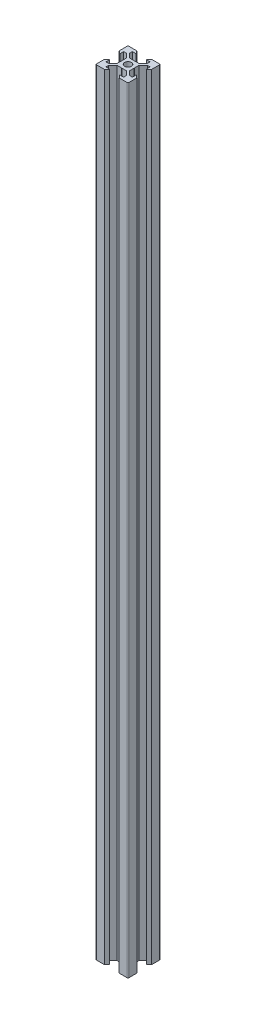
from build123d import *

# Parameters (mm, degrees)
BOSS_EXTRUDE1_DEPTH = 480


with BuildPart() as part:
    # Sketch1 → Boss-Extrude1 (new body)
    with BuildSketch(Plane(origin=(0, 0, 0), x_dir=(1, 0, 0), z_dir=(0, 1, 0))):
        with BuildLine():
            Line((20, 5.42), (20, 0.5))
            ThreePointArc((20, 0.5), (19.853553391, 0.146446609), (19.5, 0))
            Line((19.5, 0), (14.58, 0))
            Line((14.58, 0), (13.13, 1.549339828))
            Line((13.13, 1.549339828), (13.13, 1.799339828))
            Line((13.13, 1.799339828), (15.5, 1.799339828))
            Line((15.5, 1.799339828), (15.5, 3.439339828))
            Line((15.5, 3.439339828), (12.84, 6.099339828))
            Line((12.84, 6.099339828), (10.25, 6.099339828))
            Line((10.25, 6.099339828), (10, 6.349339828))
            Line((10, 6.349339828), (9.75, 6.099339828))
            Line((9.75, 6.099339828), (7.16, 6.099339828))
            Line((7.16, 6.099339828), (4.5, 3.439339828))
            Line((4.5, 3.439339828), (4.5, 1.799339828))
            Line((4.5, 1.799339828), (6.875, 1.799339828))
            Line((6.875, 1.799339828), (6.875, 1.549339828))
            Line((6.875, 1.549339828), (5.42, 0))
            Line((5.42, 0), (0.5, 0))
            ThreePointArc((0.5, 0), (0.146446609, 0.146446609), (0, 0.5))
            Line((0, 0.5), (0, 5.42))
            Line((0, 5.42), (1.549339828, 6.87))
            Line((1.549339828, 6.87), (1.799339828, 6.87))
            Line((1.799339828, 6.87), (1.799339828, 4.5))
            Line((1.799339828, 4.5), (3.439339828, 4.5))
            Line((3.439339828, 4.5), (6.099339828, 7.16))
            Line((6.099339828, 7.16), (6.099339828, 9.75))
            Line((6.099339828, 9.75), (6.349339828, 10))
            Line((6.349339828, 10), (6.099339828, 10.25))
            Line((6.099339828, 10.25), (6.099339828, 12.84))
            Line((6.099339828, 12.84), (3.439339828, 15.5))
            Line((3.439339828, 15.5), (1.799339828, 15.5))
            Line((1.799339828, 15.5), (1.799339828, 13.125))
            Line((1.799339828, 13.125), (1.549339828, 13.125))
            Line((1.549339828, 13.125), (0, 14.58))
            Line((0, 14.58), (0, 19.5))
            ThreePointArc((0, 19.5), (0.146446609, 19.853553391), (0.5, 20))
            Line((0.5, 20), (5.42, 20))
            Line((5.42, 20), (6.87, 18.450660172))
            Line((6.87, 18.450660172), (6.87, 18.200660172))
            Line((6.87, 18.200660172), (4.5, 18.200660172))
            Line((4.5, 18.200660172), (4.5, 16.560660172))
            Line((4.5, 16.560660172), (7.16, 13.900660172))
            Line((7.16, 13.900660172), (9.75, 13.900660172))
            Line((9.75, 13.900660172), (10, 13.650660172))
            Line((10, 13.650660172), (10.25, 13.900660172))
            Line((10.25, 13.900660172), (12.84, 13.900660172))
            Line((12.84, 13.900660172), (15.5, 16.560660172))
            Line((15.5, 16.560660172), (15.5, 18.200660172))
            Line((15.5, 18.200660172), (13.125, 18.200660172))
            Line((13.125, 18.200660172), (13.125, 18.450660172))
            Line((13.125, 18.450660172), (14.58, 20))
            Line((14.58, 20), (19.5, 20))
            ThreePointArc((19.5, 20), (19.853553391, 19.853553391), (20, 19.5))
            Line((20, 19.5), (20, 14.58))
            Line((20, 14.58), (18.450660172, 13.13))
            Line((18.450660172, 13.13), (18.200660172, 13.13))
            Line((18.200660172, 13.13), (18.200660172, 15.5))
            Line((18.200660172, 15.5), (16.560660172, 15.5))
            Line((16.560660172, 15.5), (13.900660172, 12.84))
            Line((13.900660172, 12.84), (13.900660172, 10.25))
            Line((13.900660172, 10.25), (13.650660172, 10))
            Line((13.650660172, 10), (13.900660172, 9.75))
            Line((13.900660172, 9.75), (13.900660172, 7.16))
            Line((13.900660172, 7.16), (16.560660172, 4.5))
            Line((16.560660172, 4.5), (18.200660172, 4.5))
            Line((18.200660172, 4.5), (18.200660172, 6.875))
            Line((18.200660172, 6.875), (18.450660172, 6.875))
            Line((18.450660172, 6.875), (20, 5.42))
        make_face()
        with BuildLine():
            ThreePointArc((12.1, 10), (11.48492424, 11.48492424), (10, 12.1))
            ThreePointArc((10, 12.1), (8.51507576, 11.48492424), (7.9, 10))
            ThreePointArc((7.9, 10), (8.51507576, 8.51507576), (10, 7.9))
            ThreePointArc((10, 7.9), (11.48492424, 8.51507576), (12.1, 10))
        make_face(mode=Mode.SUBTRACT)
    extrude(amount=BOSS_EXTRUDE1_DEPTH)


solid = part.part
